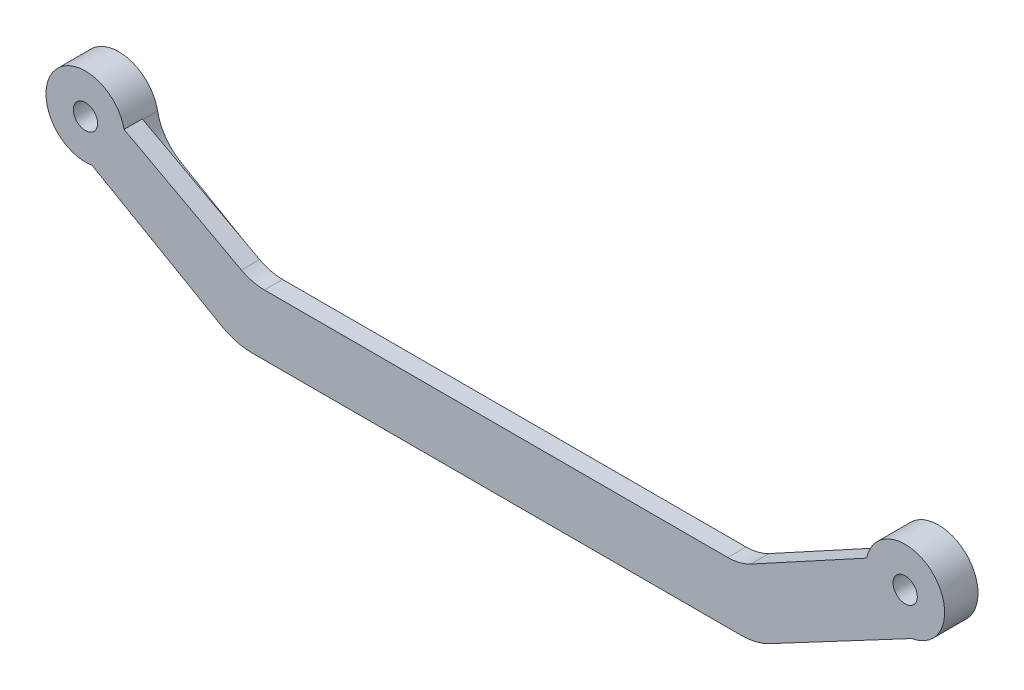
from build123d import *

# Parameters (mm, degrees)
EXTRUDE_2_DEPTH          = 2.5
EXTRUDE_3_DEPTH          = 3
CUT_EXTRUDE_1_DEPTH      = 77.94617208
CUT_EXTRUDE_1_DEPTH_BACK = 77.94617208
SKETCH_5_R               = 2
FILLET_1_R               = 10
FILLET_2_R               = 8
FILLET_3_R               = 8


with BuildPart() as part:
    # 草图1 → 凸台-拉伸2 (new body)
    with BuildSketch(Plane.XY.offset(5.5)):
        with BuildLine():
            Line((-41.12, -13.858374143), (41.12, -13.858374143))
            Line((41.12, -13.858374143), (61.27, -2.231637876))
            ThreePointArc((61.27, -2.231637876), (73.122690209, 2.892045504), (62.764706552, -4.818374143))
            Line((62.764706552, -4.818374143), (41.92, -16.858374143))
            Line((41.92, -16.858374143), (-41.92, -16.858374143))
            Line((-41.92, -16.858374143), (-62.77, -4.818374143))
            ThreePointArc((-62.77, -4.818374143), (-73.132598603, 2.884045772), (-61.27, -2.213941747))
            Line((-61.27, -2.213941747), (-41.12, -13.858374143))
        make_face()
    extrude(amount=EXTRUDE_2_DEPTH)

    # 草图4 → 凸台-拉伸3 (add)
    with BuildSketch(Plane.XY.offset(8)):
        with BuildLine():
            Line((-61.14, 0.981789849), (-40.05, -10.358374143))
            Line((-40.05, -10.358374143), (40.31, -10.358374143))
            Line((40.31, -10.358374143), (61.134706552, 0.981789849))
            ThreePointArc((61.134706552, 0.981789849), (72.181493512, 4.143779301), (68.582245444, -6.768374143))
            Line((68.582245444, -6.768374143), (42.99, -20.358374143))
            Line((42.99, -20.358374143), (-42.73, -20.358374143))
            Line((-42.73, -20.358374143), (-66.412461108, -6.768374143))
            ThreePointArc((-66.412461108, -6.768374143), (-72.874264542, 3.296129187), (-61.14, 0.981789849))
        make_face()
    extrude(amount=EXTRUDE_3_DEPTH)

    # 草图5 → 切除-拉伸1 (cut, two sides: drawn at the far end of the back side and taken through both)
    with BuildSketch(Plane.XY.offset(11).offset(-CUT_EXTRUDE_1_DEPTH_BACK)):
        with Locations((67.494706552, -0.36)):
            Circle(SKETCH_5_R)
        with Locations((-67.5, -0.36)):
            Circle(SKETCH_5_R)
    extrude(amount=CUT_EXTRUDE_1_DEPTH + CUT_EXTRUDE_1_DEPTH_BACK, mode=Mode.SUBTRACT)

    # 圆角1
    fillet_1_edges = [part.edges().sort_by_distance(p)[0] for p in [
        (41.92, -16.858374143, 6.75),
        (-41.92, -16.858374143, 6.75),
        (-42.73, -20.358374143, 9.5),
        (42.99, -20.358374143, 9.5),
    ]]
    fillet(fillet_1_edges, radius=FILLET_1_R)

    # 圆角2
    fillet_2_edges = [part.edges().sort_by_distance(p)[0] for p in [
        (61.27, -2.231637876, 6.75),
        (62.764706552, -4.818374143, 6.75),
        (-62.77, -4.818374143, 6.75),
        (-61.27, -2.213941747, 6.75),
    ]]
    fillet(fillet_2_edges, radius=FILLET_2_R)

    # 圆角3
    fillet_3_edges = [part.edges().sort_by_distance(p)[0] for p in [
        (-41.12, -13.858374143, 6.75),
        (41.12, -13.858374143, 6.75),
        (40.31, -10.358374143, 9.5),
        (-40.05, -10.358374143, 9.5),
    ]]
    fillet(fillet_3_edges, radius=FILLET_3_R)


solid = part.part
